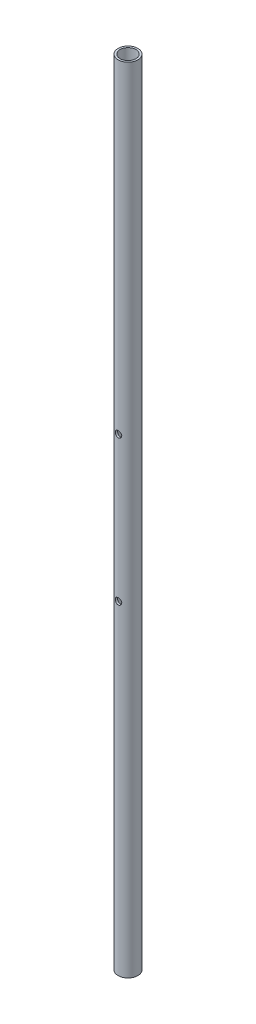
from build123d import *

# Parameters (mm, degrees)
ESBO_O1_R                  = 5
ESBO_O1_R_2                = 4
RESSALTO_EXTRUS_O1_DEPTH   = 400
CORTE_EXTRUS_O1_DEPTH      = 401.062495118
CORTE_EXTRUS_O1_DEPTH_BACK = 401.062495118
ESBO_O2_R                  = 1.6


with BuildPart() as part:
    # Esboço1 → Ressalto-extrusão1 (new body)
    with BuildSketch(Plane(origin=(0, 0, 0), x_dir=(1, 0, 0), z_dir=(0, 1, 0))):
        with Locations(Location((0, 0, 0), (0, 0, 270))):
            Circle(ESBO_O1_R)
        with Locations(Location((0, 0, 0), (0, 0, 270))):
            Circle(ESBO_O1_R_2, mode=Mode.SUBTRACT)
    extrude(amount=RESSALTO_EXTRUS_O1_DEPTH)

    # Esboço2 → Corte-extrusão1 (cut, two sides: drawn at the far end of the back side and taken through both)
    with BuildSketch(Plane.XY.offset(-CORTE_EXTRUS_O1_DEPTH_BACK)):
        with Locations((0, 236.5)):
            Circle(ESBO_O2_R)
        with Locations((0, 163.5)):
            Circle(ESBO_O2_R)
    extrude(amount=CORTE_EXTRUS_O1_DEPTH + CORTE_EXTRUS_O1_DEPTH_BACK, mode=Mode.SUBTRACT)


solid = part.part
